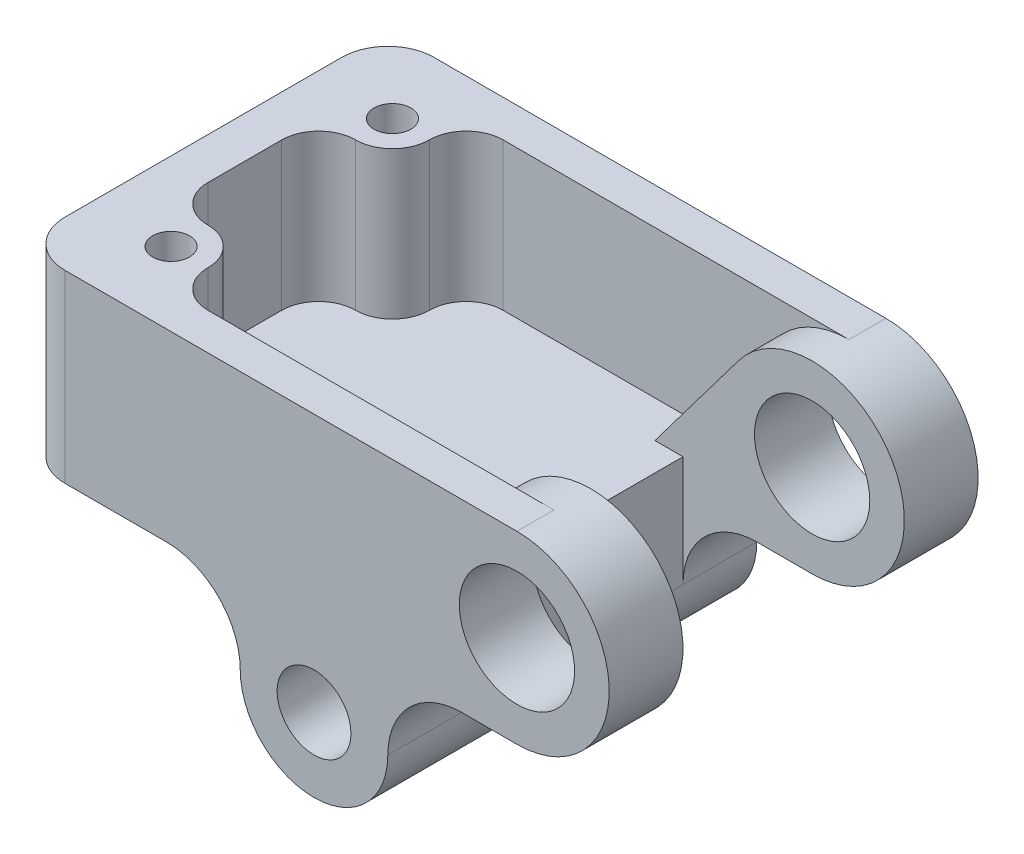
from build123d import *

# Parameters (mm, degrees)
SKETCH1_R             = 8
SKETCH1_R_2           = 12.5
BOSS_EXTRUDE1_DEPTH   = 40
CUT_EXTRUDE1_DEPTH    = 32
SKETCH3_W             = 44
SKETCH3_H             = 64
CUT_EXTRUDE2_DEPTH    = 32
BOSS_EXTRUDE2_START   = 8
SKETCH4_R             = 12.5
BOSS_EXTRUDE2_DEPTH   = 8
F_8_0MM_DOWEL_HOLE1_D = 8
FILLET1_R             = 10
SKETCH6_R             = 4
BOSS_EXTRUDE3_DEPTH   = 8


with BuildPart() as part:
    # Sketch1 → Boss-Extrude1 (new, symmetric)
    with BuildSketch(Plane.XY):
        with BuildLine():
            Line((-64, 56), (-64, 16))
            Line((-64, 16), (-32, 16))
            ThreePointArc((-32, 16), (-20.686291501, 11.313708499), (-16, 0))
            ThreePointArc((-16, 0), (0, -16), (16, 0))
            ThreePointArc((16, 0), (20.686291501, 11.313708499), (32, 16))
            Line((32, 16), (44, 16))
            ThreePointArc((44, 16), (64, 36), (44, 56))
            Line((44, 56), (-64, 56))
        make_face()
        Circle(SKETCH1_R, mode=Mode.SUBTRACT)
        with Locations((44, 36)):
            Circle(SKETCH1_R_2, mode=Mode.SUBTRACT)
    extrude(amount=BOSS_EXTRUDE1_DEPTH, both=True)

    # Sketch2 → Cut-Extrude1 (cut)
    with BuildSketch(Plane(origin=(0, 56, 0), x_dir=(1, 0, 0), z_dir=(0, 1, 0))):
        with BuildLine():
            Line((64, 32), (-31, 32))
            ThreePointArc((-31, 32), (-36.656854249, 29.656854249), (-39, 24))
            ThreePointArc((-39, 24), (-41.343145751, 18.343145751), (-47, 16))
            ThreePointArc((-47, 16), (-52.656854249, 13.656854249), (-55, 8))
            Line((-55, 8), (-55, -8))
            ThreePointArc((-55, -8), (-52.656854249, -13.656854249), (-47, -16))
            ThreePointArc((-47, -16), (-41.343145751, -18.343145751), (-39, -24))
            ThreePointArc((-39, -24), (-36.656854249, -29.656854249), (-31, -32))
            Line((-31, -32), (64, -32))
            Line((64, -32), (64, 32))
        make_face()
    extrude(amount=-CUT_EXTRUDE1_DEPTH, mode=Mode.SUBTRACT)

    # Sketch3 → Cut-Extrude2 (cut)
    with BuildSketch(Plane(origin=(0, 24, 0), x_dir=(1, 0, 0), z_dir=(0, 1, 0))):
        with Locations((38, 0)):
            Rectangle(SKETCH3_W, SKETCH3_H)
    extrude(amount=-CUT_EXTRUDE2_DEPTH, mode=Mode.SUBTRACT)

    # Sketch4 → Boss-Extrude2 (add)
    # profile 1 of 2: a face of its own
    with BuildSketch(Plane.XY.offset(-32).offset(BOSS_EXTRUDE2_START)):
        with BuildLine():
            ThreePointArc((44, 56), (35.076043738, 53.898687232), (28.027289799, 48.036300463))
            ThreePointArc((28.027289799, 48.036300463), (26.101312768, 27.076043738), (44, 16))
            ThreePointArc((44, 16), (58.142135624, 21.857864376), (64, 36))
            ThreePointArc((64, 36), (58.142135624, 50.142135624), (44, 56))
        make_face()
        with Locations((44, 36)):
            Circle(SKETCH4_R, mode=Mode.SUBTRACT)
    # profile 2 of 2: a face of its own
    with BuildSketch(Plane.XY.offset(-32).offset(BOSS_EXTRUDE2_START)):
        with BuildLine():
            ThreePointArc((44, 16), (26.101312768, 27.076043738), (28.027289799, 48.036300463))
            Line((28.027289799, 48.036300463), (9.914638236, 24))
            Line((9.914638236, 24), (16, 24))
            Line((16, 24), (16, 0))
            ThreePointArc((16, 0), (20.686291501, 11.313708499), (32, 16))
            Line((32, 16), (44, 16))
        make_face()
    boss_extrude2 = extrude(amount=-BOSS_EXTRUDE2_DEPTH)

    # Mirror1: Boss-Extrude2 across plane
    add(boss_extrude2.mirror(Plane.XY))

    # Ø8.0mm Dowel Hole1 (through all)
    with Locations(Plane(origin=(-47, 56, -24), x_dir=(1, 0, 0), z_dir=(0, 1, 0))):
        with Locations((0, 0), (0, -48)):
            Hole(F_8_0MM_DOWEL_HOLE1_D / 2)

    # Fillet1
    fillet1_edges = [part.edges().sort_by_distance(p)[0] for p in [
        (-64, 36, -40),
        (-64, 36, 40),
    ]]
    fillet(fillet1_edges, radius=FILLET1_R)

    # Sketch6 → Boss-Extrude3 (add)
    with BuildSketch(Plane.ZY.offset(64)):
        with BuildLine():
            Line((-16, 16), (-16, 32))
            ThreePointArc((-16, 32), (0, 48), (16, 32))
            Line((16, 32), (16, 16))
            Line((16, 16), (-16, 16))
        make_face()
        with Locations((0, 32)):
            Circle(SKETCH6_R, mode=Mode.SUBTRACT)
    extrude(amount=BOSS_EXTRUDE3_DEPTH)


solid = part.part
